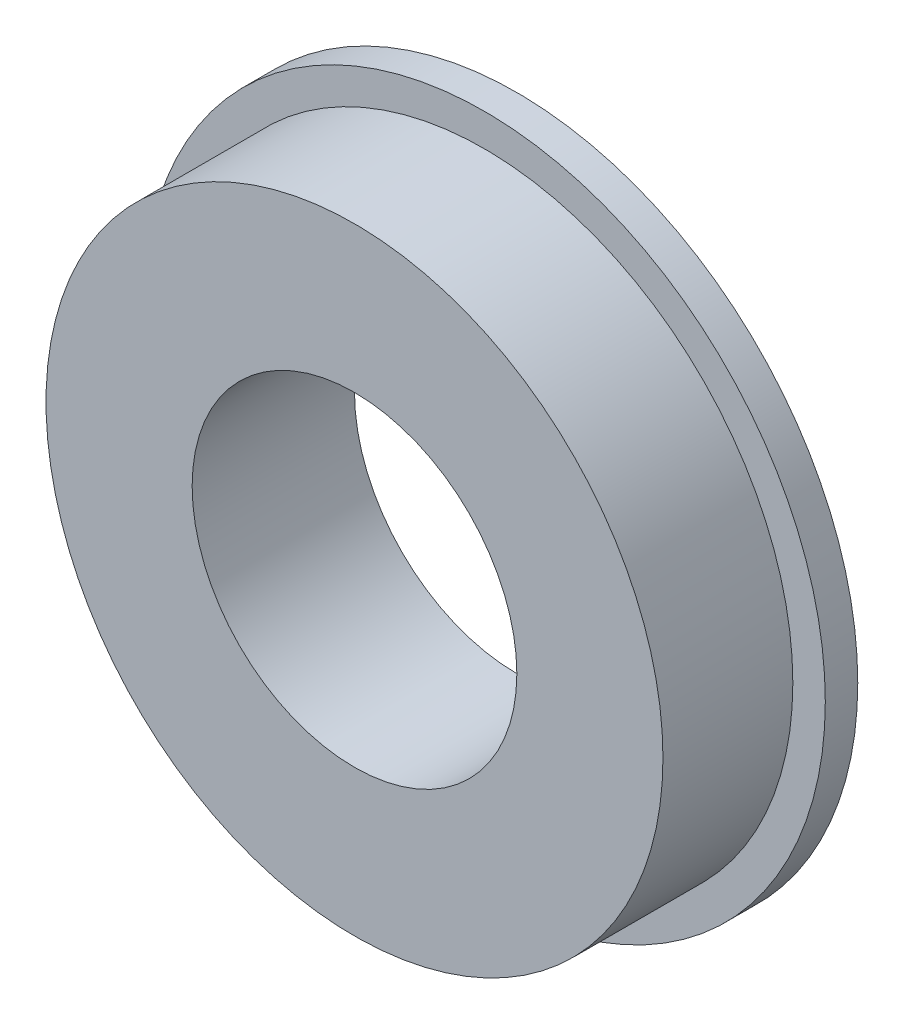
from build123d import *

# Parameters (mm, degrees)
SKETCH_1_R          = 10.5
EXTRUDE_1_DEPTH     = 1
SKETCH_2_R          = 9.5
EXTRUDE_2_DEPTH     = 4
SKETCH_3_R          = 5
CUT_EXTRUDE_1_DEPTH = 5


with BuildPart() as part:
    # 草图1 → 凸台-拉伸1 (new body)
    with BuildSketch(Plane.XY):
        Circle(SKETCH_1_R)
    extrude(amount=EXTRUDE_1_DEPTH)

    # 草图2 → 凸台-拉伸2 (add)
    with BuildSketch(Plane.XY.offset(1)):
        Circle(SKETCH_2_R)
    extrude(amount=EXTRUDE_2_DEPTH)

    # 草图3 → 切除-拉伸1 (cut)
    with BuildSketch(Plane.XY.offset(5)):
        Circle(SKETCH_3_R)
    extrude(amount=-CUT_EXTRUDE_1_DEPTH, mode=Mode.SUBTRACT)


solid = part.part
